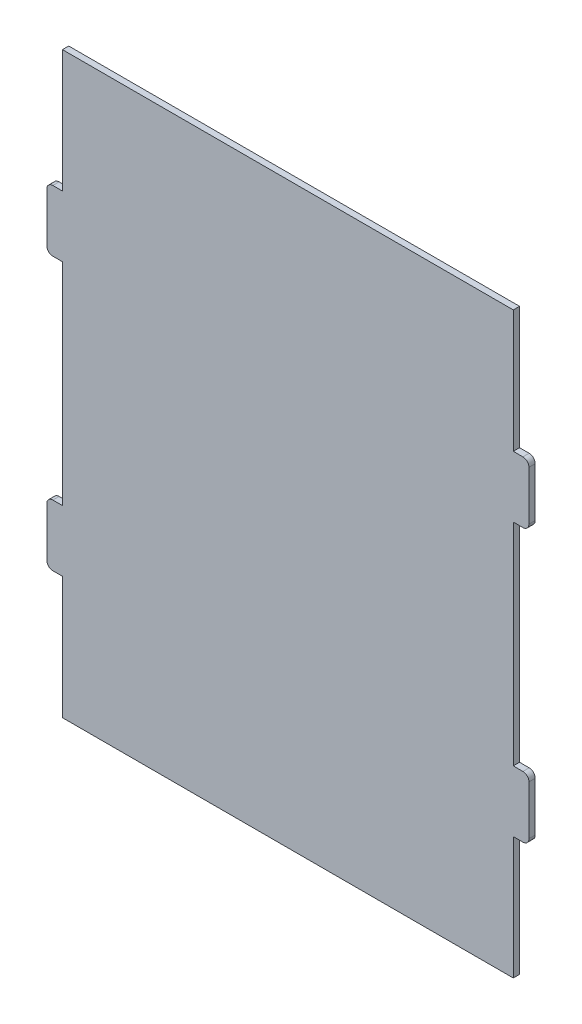
from build123d import *

# Parameters (mm, degrees)
BOSS_EXTRUDE1_DEPTH = 2.6


with BuildPart() as part:
    # Model → Boss-Extrude1 (new body)
    with BuildSketch(Plane.XY):
        with BuildLine():
            Line((-97.5, -43.8), (-93.5, -43.8))
            Line((-93.5, -43.8), (-93.5, 43.8))
            Line((-93.5, 43.8), (-97.5, 43.8))
            ThreePointArc((-97.5, 43.8), (-99.267766953, 44.532233047), (-100, 46.3))
            Line((-100, 46.3), (-100, 66.7))
            ThreePointArc((-100, 66.7), (-99.267766953, 68.467766953), (-97.5, 69.2))
            Line((-97.5, 69.2), (-93.5, 69.2))
            Line((-93.5, 69.2), (-93.5, 120))
            Line((-93.5, 120), (93.5, 120))
            Line((93.5, 120), (93.5, 69.2))
            Line((93.5, 69.2), (97.5, 69.2))
            ThreePointArc((97.5, 69.2), (99.267766953, 68.467766953), (100, 66.7))
            Line((100, 66.7), (100, 46.3))
            ThreePointArc((100, 46.3), (99.267766953, 44.532233047), (97.5, 43.8))
            Line((97.5, 43.8), (93.5, 43.8))
            Line((93.5, 43.8), (93.5, -43.8))
            Line((93.5, -43.8), (97.5, -43.8))
            ThreePointArc((97.5, -43.8), (99.267766953, -44.532233047), (100, -46.3))
            Line((100, -46.3), (100, -66.7))
            ThreePointArc((100, -66.7), (99.267766953, -68.467766953), (97.5, -69.2))
            Line((97.5, -69.2), (93.5, -69.2))
            Line((93.5, -69.2), (93.5, -120))
            Line((93.5, -120), (-93.5, -120))
            Line((-93.5, -120), (-93.5, -69.2))
            Line((-93.5, -69.2), (-97.5, -69.2))
            ThreePointArc((-97.5, -69.2), (-99.267766953, -68.467766953), (-100, -66.7))
            Line((-100, -66.7), (-100, -46.3))
            ThreePointArc((-100, -46.3), (-99.267766953, -44.532233047), (-97.5, -43.8))
        make_face()
    extrude(amount=BOSS_EXTRUDE1_DEPTH)


solid = part.part
